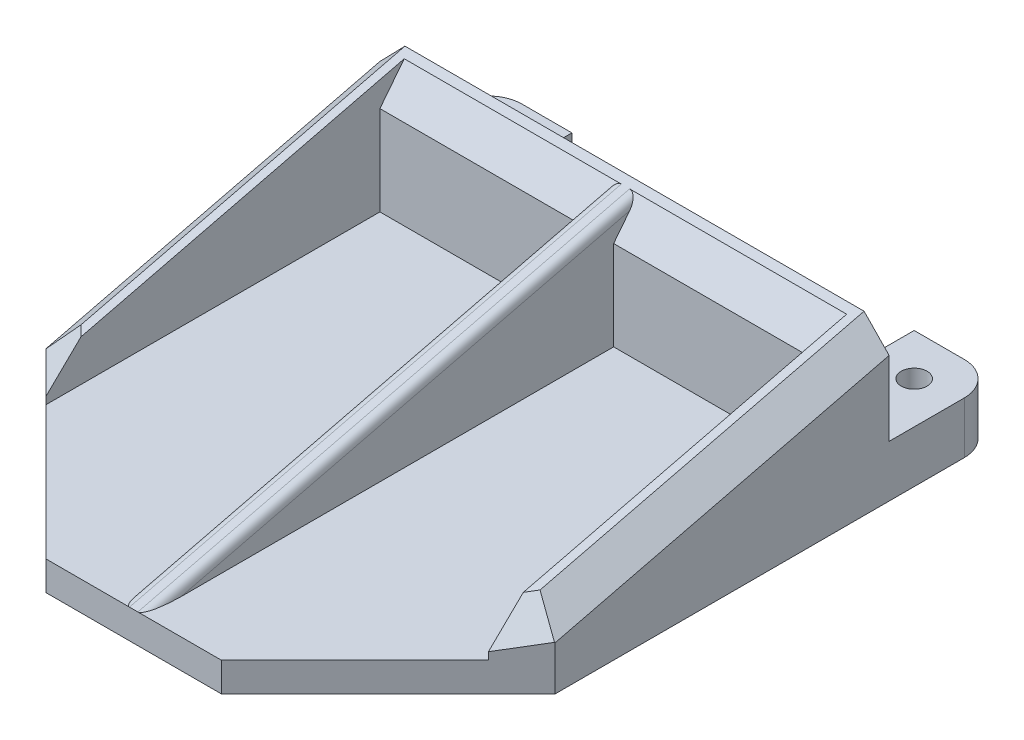
from build123d import *

# Parameters (mm, degrees)
SKETCH1_R                = 1.55
BOSS_EXTRUDE1_DEPTH      = 1.75
SKETCH2_R                = 1.55
BOSS_EXTRUDE2_DEPTH      = 2.7
BOSS_EXTRUDE3_DEPTH      = 30.5
BOSS_EXTRUDE3_DEPTH_BACK = 30.5
CUT_EXTRUDE1_DEPTH       = 14.7
CHAMFER2_SIZE            = 3
FILLET2_R                = 1


with BuildPart() as part:
    # Sketch1 → Boss-Extrude1 (new, symmetric)
    # profile 1 of 3: a face of its own
    with BuildSketch(Plane(origin=(0, 0, 0), x_dir=(1, 0, 0), z_dir=(0, 1, 0))):
        Polygon((-10.5, -31.5), (-30.5, -11.5), (-30.5, 31.5), (30.5, 31.5), (30.5, -11.5), (10.5, -31.5), align=None)
    # profile 2 of 3: a face of its own
    with BuildSketch(Plane(origin=(0, 0, 0), x_dir=(1, 0, 0), z_dir=(0, 1, 0))):
        with BuildLine():
            Line((20.5, 31.5), (30.5, 31.5))
            Line((30.5, 31.5), (30.5, 37.5))
            ThreePointArc((30.5, 37.5), (29.328427125, 40.328427125), (26.5, 41.5))
            Line((26.5, 41.5), (20.5, 41.5))
            Line((20.5, 41.5), (20.5, 31.5))
        make_face()
        with Locations(Location((25.5, 36.5, 0), (0, 0, 270))):
            Circle(SKETCH1_R, mode=Mode.SUBTRACT)
    # profile 3 of 3: a face of its own
    with BuildSketch(Plane(origin=(0, 0, 0), x_dir=(1, 0, 0), z_dir=(0, 1, 0))):
        with BuildLine():
            Line((-30.5, 31.5), (-20.5, 31.5))
            Line((-20.5, 31.5), (-20.5, 41.5))
            Line((-20.5, 41.5), (-26.5, 41.5))
            ThreePointArc((-26.5, 41.5), (-29.328427125, 40.328427125), (-30.5, 37.5))
            Line((-30.5, 37.5), (-30.5, 31.5))
        make_face()
        with Locations(Location((-25.5, 36.5, 0), (0, 0, 270))):
            Circle(SKETCH1_R, mode=Mode.SUBTRACT)
    extrude(amount=BOSS_EXTRUDE1_DEPTH, both=True)

    # Sketch2 → Boss-Extrude2 (add)
    # profile 1 of 3: a face of its own
    with BuildSketch(Plane(origin=(0, 1.75, 0), x_dir=(1, 0, 0), z_dir=(0, 1, 0))):
        with BuildLine():
            Line((-20.5, 31.5), (-20.5, 41.5))
            Line((-20.5, 41.5), (-26.5, 41.5))
            ThreePointArc((-26.5, 41.5), (-29.328427125, 40.328427125), (-30.5, 37.5))
            Line((-30.5, 37.5), (-30.5, 31.5))
            Line((-30.5, 31.5), (-20.5, 31.5))
        make_face()
        with Locations(Location((-25.5, 36.5, 0), (0, 0, 270))):
            Circle(SKETCH2_R, mode=Mode.SUBTRACT)
    # profile 2 of 3: a face of its own
    with BuildSketch(Plane(origin=(0, 1.75, 0), x_dir=(1, 0, 0), z_dir=(0, 1, 0))):
        Polygon((20.5, 31.5), (-20.5, 31.5), (-30.5, 31.5), (-30.5, 28.5), (30.5, 28.5), (30.5, 31.5), align=None)
    # profile 3 of 3: a face of its own
    with BuildSketch(Plane(origin=(0, 1.75, 0), x_dir=(1, 0, 0), z_dir=(0, 1, 0))):
        with BuildLine():
            Line((20.5, 41.5), (20.5, 31.5))
            Line((20.5, 31.5), (30.5, 31.5))
            Line((30.5, 31.5), (30.5, 37.5))
            ThreePointArc((30.5, 37.5), (29.328427125, 40.328427125), (26.5, 41.5))
            Line((26.5, 41.5), (20.5, 41.5))
        make_face()
        with Locations(Location((25.5, 36.5, 0), (0, 0, 270))):
            Circle(SKETCH2_R, mode=Mode.SUBTRACT)
    extrude(amount=BOSS_EXTRUDE2_DEPTH)

    # Sketch3 → Boss-Extrude3 (add, two sides: drawn at the far end of the back side and taken through both)
    with BuildSketch(Plane(origin=(0, 0, 0), x_dir=(0, 0, -1), z_dir=(1, 0, 0)).offset(-BOSS_EXTRUDE3_DEPTH_BACK)):
        Polygon((28.5, 1.75), (-31.5, 1.75), (28.5, 16.45), align=None)
    extrude(amount=BOSS_EXTRUDE3_DEPTH + BOSS_EXTRUDE3_DEPTH_BACK)

    # Sketch4 → Cut-Extrude1 (cut)
    with BuildSketch(Plane(origin=(0, 16.45, 0), x_dir=(-1, 0, 0), z_dir=(0, -1, 0))):
        Polygon((26.5, -15.5), (26.5, 24.5), (1.5, 24.5), (1.5, -31.5), (10.5, -31.5), align=None)
        Polygon((-26.5, -15.5), (-10.5, -31.5), (-1.5, -31.5), (-1.5, 24.5), (-26.5, 24.5), align=None)
        Polygon((26.5, -31.5), (26.5, -15.5), (10.5, -31.5), align=None)
        Polygon((30.5, -11.5), (26.5, -15.5), (26.5, -31.5), (30.5, -31.5), align=None)
        Polygon((-26.5, -15.5), (-26.5, -31.5), (-10.5, -31.5), align=None)
        Polygon((-30.5, -31.5), (-26.5, -31.5), (-26.5, -15.5), (-30.5, -11.5), align=None)
    extrude(amount=CUT_EXTRUDE1_DEPTH, mode=Mode.SUBTRACT)

    # Chamfer2
    chamfer2_edges = [part.edges().sort_by_distance(p)[0] for p in [
        (28.5, 6.16, 13.5),
        (14, 15.47, -24.5),
        (-14, 15.47, -24.5),
        (-28.5, 6.16, 13.5),
        (-30.5, 11.55, -8.5),
        (30.5, 11.55, -8.5),
    ]]
    chamfer(chamfer2_edges, length=CHAMFER2_SIZE)

    # Fillet2
    fillet2_edges = [part.edges().sort_by_distance(p)[0] for p in [
        (1.5, 8.966943345, 2.043088387),
        (-1.5, 8.966943345, 2.043088387),
    ]]
    fillet(fillet2_edges, radius=FILLET2_R)


solid = part.part
